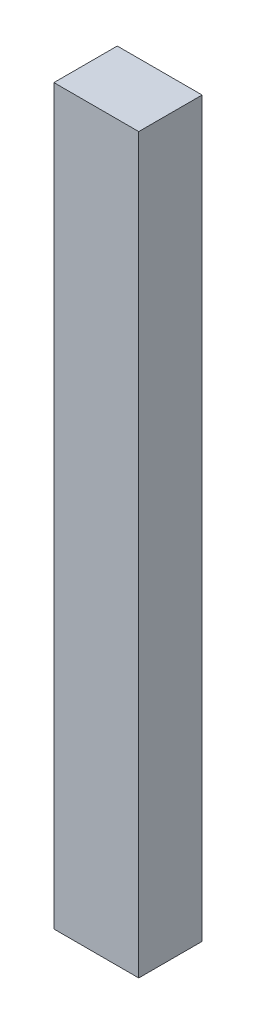
from build123d import *

# Parameters (mm, degrees)
SKETCH1_W           = 58.800188212
SKETCH1_H           = 43.904140532
BOSS_EXTRUDE1_DEPTH = 508


with BuildPart() as part:
    # Sketch1 → Boss-Extrude1 (new body)
    with BuildSketch(Plane(origin=(0, 0, 0), x_dir=(1, 0, 0), z_dir=(0, 1, 0))):
        with Locations((1.568005019, -2.548008156)):
            Rectangle(SKETCH1_W, SKETCH1_H)
    extrude(amount=BOSS_EXTRUDE1_DEPTH)


solid = part.part
